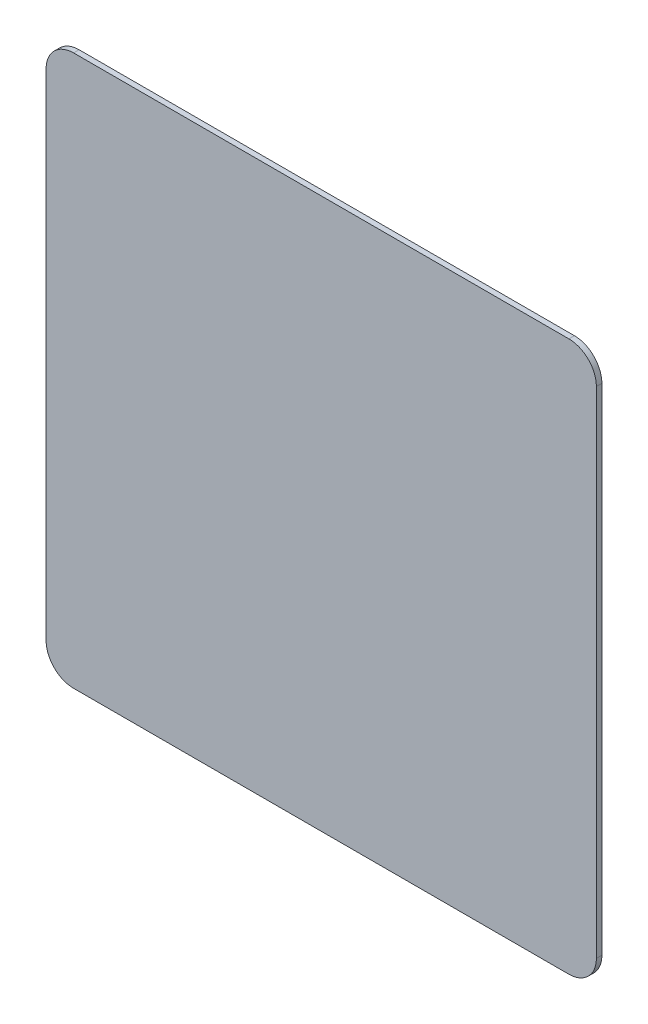
from build123d import *

# Parameters (mm, degrees)
BOSS_EXTRUDE1_DEPTH = 2


with BuildPart() as part:
    # Sketch1 → Boss-Extrude1 (new body)
    with BuildSketch(Plane.XY):
        with BuildLine():
            Line((-90, -100), (90, -100))
            ThreePointArc((90, -100), (97.071067812, -97.071067812), (100, -90))
            Line((100, -90), (100, 90))
            ThreePointArc((100, 90), (97.071067812, 97.071067812), (90, 100))
            Line((90, 100), (-90, 100))
            ThreePointArc((-90, 100), (-97.071067812, 97.071067812), (-100, 90))
            Line((-100, 90), (-100, -90))
            ThreePointArc((-100, -90), (-97.071067812, -97.071067812), (-90, -100))
        make_face()
    extrude(amount=BOSS_EXTRUDE1_DEPTH)


solid = part.part
